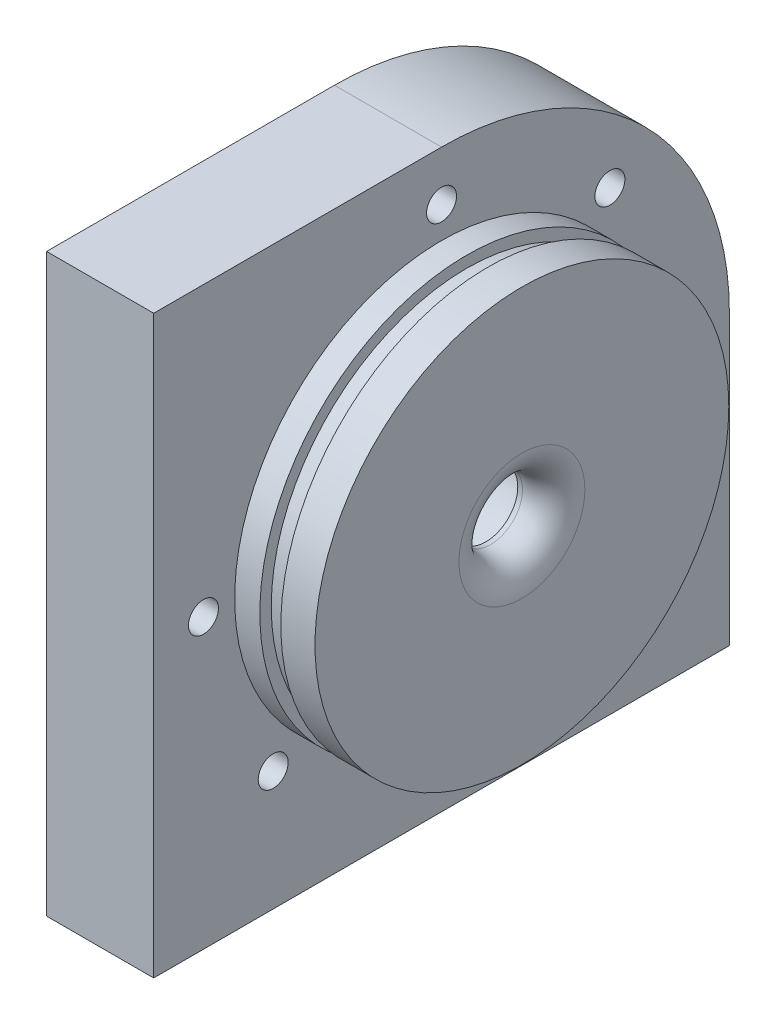
from build123d import *

# Parameters (mm, degrees)
SKETCH1_R                     = 43.815
HOUSING_FITTING_EXTRUDE_DEPTH = 17.018
HOUSING_BODY_1_DEPTH          = 22.6822
SKETCH3_R                     = 6.731
IMPELLER_BORE_DEPTH           = 17.018
SKETCH4_R                     = 4
SHAFT_BORE_DEPTH              = 70.612
O_RING_CUT_DEPTH              = 1.27
O_RING_CUT_DEPTH_BACK         = 3.175
SKETCH5_R                     = 43.942
SKETCH5_R_2                   = 41.402
SKETCH12_R                    = 3.175
CUT_EXTRUDE2_DEPTH            = 19.05
CIRPATTERN1_COUNT             = 8
SKETCH14_R                    = 3.175
SKETCH14_R_2                  = 3.392842108
CUT_EXTRUDE4_DEPTH            = 16.51
SKETCH15_R                    = 3.175
CUT_EXTRUDE5_DEPTH            = 10.922
FILLET1_R                     = 6.604
SKETCH16_R                    = 11.811
CUT_EXTRUDE7_DEPTH            = 32.0929
SKETCH17_R                    = 19.558
CUT_EXTRUDE8_DEPTH            = 13.0429


with BuildPart() as part:
    # Sketch1 → Housing Fitting Extrude (new body)
    with BuildSketch(Plane(origin=(0, 0, 0), x_dir=(0, 0, -1), z_dir=(1, 0, 0))):
        Circle(SKETCH1_R)
    extrude(amount=HOUSING_FITTING_EXTRUDE_DEPTH)

    # Sketch2 → Housing Body 1 (add)
    with BuildSketch(Plane.ZY):
        with BuildLine():
            Line((60.96, 0), (60.96, 60.96))
            Line((60.96, 60.96), (0, 60.96))
            ThreePointArc((0, 60.96), (-43.105229381, 43.105229381), (-60.96, 0))
            Line((-60.96, 0), (-60.96, -54.61))
            Line((-60.96, -54.61), (-60.96, -60.96))
            Line((-60.96, -60.96), (60.96, -60.96))
            Line((60.96, -60.96), (60.96, -54.61))
            Line((60.96, -54.61), (60.96, 0))
        make_face()
    extrude(amount=HOUSING_BODY_1_DEPTH)

    # Sketch3 → Impeller Bore (cut)
    with BuildSketch(Plane(origin=(17.018, 0, 0), x_dir=(0, 0, -1), z_dir=(1, 0, 0))):
        Circle(SKETCH3_R)
    extrude(amount=-IMPELLER_BORE_DEPTH, mode=Mode.SUBTRACT)

    # Sketch4 → Shaft Bore (cut)
    with BuildSketch(Plane(origin=(0, 0, 0), x_dir=(0, 0, -1), z_dir=(1, 0, 0))):
        Circle(SKETCH4_R)
    extrude(amount=-SHAFT_BORE_DEPTH, mode=Mode.SUBTRACT)

    # Sketch5 → O-Ring Cut (cut, two sides: drawn at the far end of the back side and taken through both)
    with BuildSketch(Plane(origin=(8.509, 0, 0), x_dir=(0, 0, -1), z_dir=(1, 0, 0)).offset(-O_RING_CUT_DEPTH_BACK)):
        Circle(SKETCH5_R)
        Circle(SKETCH5_R_2, mode=Mode.SUBTRACT)
    extrude(amount=O_RING_CUT_DEPTH + O_RING_CUT_DEPTH_BACK, mode=Mode.SUBTRACT)

    # Sketch12 → Cut-Extrude2 (cut)
    with BuildSketch(Plane(origin=(0, 0, 0), x_dir=(0, 0, -1), z_dir=(1, 0, 0))):
        with Locations((-50.419, 0)):
            Circle(SKETCH12_R)
    cut_extrude2 = extrude(amount=-CUT_EXTRUDE2_DEPTH, mode=Mode.SUBTRACT)

    # CirPattern1: Cut-Extrude2 ×8 about axis, 1 skipped
    cirpattern1_axis = Axis((0, 0, 0), (1, 0, 0))
    add([cut_extrude2.rotate(cirpattern1_axis, i * 360 / CIRPATTERN1_COUNT) for i in range(1, CIRPATTERN1_COUNT) if i not in (7,)], mode=Mode.SUBTRACT)

    # Sketch14 → Cut-Extrude4 (cut)
    with BuildSketch(Plane.XZ.offset(60.96)):
        with Locations(Location((-9.525, -46.754349092, 0), (0, 0, 270))):
            Circle(SKETCH14_R)
        with Locations(Location((-9.525, 41.914080666, 0), (0, 0, 270))):
            Circle(SKETCH14_R_2)
    extrude(amount=-CUT_EXTRUDE4_DEPTH, mode=Mode.SUBTRACT)

    # Sketch15 → Cut-Extrude5 (cut)
    with BuildSketch(Plane(origin=(0, 0, -60.96), x_dir=(-1, 0, 0), z_dir=(0, 0, -1))):
        with Locations(Location((9.525, -39.337514031, 0), (0, 0, 90))):
            Circle(SKETCH15_R)
    extrude(amount=-CUT_EXTRUDE5_DEPTH, mode=Mode.SUBTRACT)

    # Fillet1
    fillet1_edges = [part.edges().sort_by_distance(p)[0] for p in [
        (17.018, 0, 6.731),
    ]]
    fillet(fillet1_edges, radius=FILLET1_R)

    # Sketch16 → Cut-Extrude7 (cut)
    with BuildSketch(Plane.ZY.offset(22.6822)):
        Circle(SKETCH16_R)
    extrude(amount=-CUT_EXTRUDE7_DEPTH, mode=Mode.SUBTRACT)

    # Sketch17 → Cut-Extrude8 (cut)
    with BuildSketch(Plane.ZY.offset(22.6822)):
        Circle(SKETCH17_R)
    extrude(amount=-CUT_EXTRUDE8_DEPTH, mode=Mode.SUBTRACT)


solid = part.part
